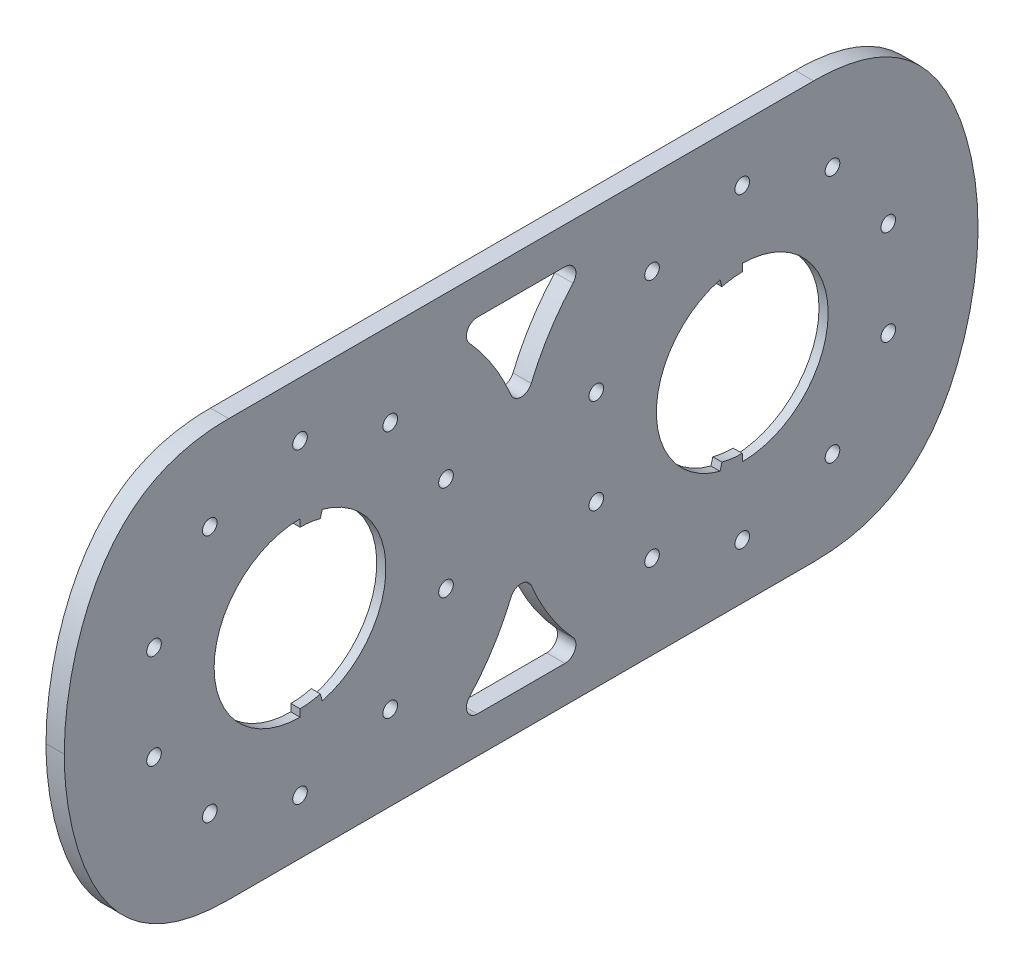
from build123d import *

# Parameters (mm, degrees)
EXTRUDE_1_DEPTH          = 5
SKETCH_2_R               = 31
CUT_EXTRUDE_1_DEPTH      = 2.5
CUT_EXTRUDE_2_REACH      = 139.474
SKETCH_3_R               = 2
PATTERN_CIRCULAR_1_COUNT = 10
CUT_EXTRUDE_3_REACH      = 139.405
SKETCH_4_R               = 23.5
EXTRUDE_START            = -2.5
EXTRUDE_3_DEPTH          = 2.5
CUT_EXTRUDE_4_DEPTH      = 10


with BuildPart() as part:
    # 草图1 → 凸台-拉伸1 (new body)
    with BuildSketch(Plane(origin=(0, 0, 0), x_dir=(0, 0, -1), z_dir=(1, 0, 0))):
        with BuildLine():
            Line((0, 57), (80, 57))
            add(Edge.make_bspline(
                [(80, 57), (110.715171184, 57), (118.023084898, 36.99301361), (125, 20.498008369), (125, 0)],
                knots=[0, 0, 0, 0, 0, 1, 1, 1, 1, 1], degree=4))
            add(Edge.make_bspline(
                [(80, -57), (110.715171184, -57), (118.023084898, -36.99301361), (125, -20.498008369), (125, 0)],
                knots=[0, 0, 0, 0, 0, 1, 1, 1, 1, 1], degree=4))
            Line((80, -57), (0, -57))
            Line((0, -57), (0, 57))
        make_face()
    extrude(amount=EXTRUDE_1_DEPTH)

    # 草图2 → 切除-拉伸1 (cut)
    with BuildSketch(Plane.ZY):
        with Locations((-60.5, 0)):
            Circle(SKETCH_2_R)
    extrude(amount=-CUT_EXTRUDE_1_DEPTH, mode=Mode.SUBTRACT)

    # 草图3 → 切除-拉伸2 (cut, up to next)
    with BuildSketch(Plane.ZY, mode=Mode.PRIVATE) as cut_extrude_2_sk1:
        with Locations((-60.5, 42)):
            Circle(SKETCH_3_R)
    cut_extrude_2_tool1 = extrude(cut_extrude_2_sk1.sketch, amount=-CUT_EXTRUDE_2_REACH, mode=Mode.PRIVATE) & part.part
    cut_extrude_2 = cut_extrude_2_tool1.solids().sort_by_distance((0, 42, -60.5))[0]
    add(cut_extrude_2, mode=Mode.SUBTRACT)

    # 阵列(圆周)1: 切除-拉伸2 ×10 about axis
    pattern_circular_1_axis = Axis((0, 0, -60.5), (1, 0, 0))
    for i in range(1, PATTERN_CIRCULAR_1_COUNT):
        add(cut_extrude_2.rotate(pattern_circular_1_axis, i * 360 / PATTERN_CIRCULAR_1_COUNT), mode=Mode.SUBTRACT)

    # 草图4 → 切除-拉伸3 (cut, up to next)
    with BuildSketch(Plane.ZY.offset(-2.5), mode=Mode.PRIVATE) as cut_extrude_3_sk1:
        with Locations((-60.5, 0)):
            Circle(SKETCH_4_R)
    cut_extrude_3_tool1 = extrude(cut_extrude_3_sk1.sketch, amount=-CUT_EXTRUDE_3_REACH, mode=Mode.PRIVATE) & part.part
    add(cut_extrude_3_tool1.solids().sort_by_distance((2.5, 0, -60.5))[0], mode=Mode.SUBTRACT)

    # 草图8 → 凸台-拉伸3 (add)
    with BuildSketch(Plane(origin=(5, 0, 0), x_dir=(0, 0, -1), z_dir=(1, 0, 0)).offset(EXTRUDE_START)):
        with BuildLine():
            Line((54.93539053, 20.767405265), (54.41775244, 22.699256918))
            ThreePointArc((54.41775244, 22.699256918), (57.432634483, 23.298954242), (60.5, 23.5))
            Line((60.5, 23.5), (60.5, 21.5))
            ThreePointArc((60.5, 21.5), (57.693686867, 21.31606452), (54.93539053, 20.767405265))
        make_face()
        with BuildLine():
            Line((60.5, -21.5), (60.5, -23.5))
            ThreePointArc((60.5, -23.5), (57.432634483, -23.298954242), (54.41775244, -22.699256918))
            Line((54.41775244, -22.699256918), (54.93539053, -20.767405265))
            ThreePointArc((54.93539053, -20.767405265), (57.693686867, -21.31606452), (60.5, -21.5))
        make_face()
    extrude(amount=EXTRUDE_3_DEPTH)

    # 镜向3: part across plane


with BuildPart() as part_1:
    add(part.part)
    add(part.part.mirror(Plane(origin=(5, 57, 0), x_dir=(1, 0, 0), z_dir=(0, 0, -1))))

    # 草图10 → 切除-拉伸4 (cut)
    with BuildSketch(Plane(origin=(5, 0, 0), x_dir=(0, 0, -1), z_dir=(1, 0, 0))):
        with BuildLine():
            Line((11.979385824, 47), (-11.979385824, 47))
            ThreePointArc((-11.979385824, 47), (-14.722176513, 45.215359715), (-14.201704031, 41.984732824))
            ThreePointArc((-14.201704031, 41.984732824), (-7.710501584, 33.45921184), (-2.770992366, 23.950191599))
            ThreePointArc((-2.770992366, 23.950191599), (0, 22.099800796), (2.770992366, 23.950191599))
            ThreePointArc((2.770992366, 23.950191599), (7.710501584, 33.45921184), (14.201704031, 41.984732824))
            ThreePointArc((14.201704031, 41.984732824), (14.722176513, 45.215359715), (11.979385824, 47))
        make_face()
        with BuildLine():
            Line((11.979385824, -47), (-11.979385824, -47))
            ThreePointArc((-11.979385824, -47), (-14.722176513, -45.215359715), (-14.201704031, -41.984732824))
            ThreePointArc((-14.201704031, -41.984732824), (-7.710501584, -33.45921184), (-2.770992366, -23.950191599))
            ThreePointArc((-2.770992366, -23.950191599), (0, -22.099800796), (2.770992366, -23.950191599))
            ThreePointArc((2.770992366, -23.950191599), (7.710501584, -33.45921184), (14.201704031, -41.984732824))
            ThreePointArc((14.201704031, -41.984732824), (14.722176513, -45.215359715), (11.979385824, -47))
        make_face()
    extrude(amount=-CUT_EXTRUDE_4_DEPTH, mode=Mode.SUBTRACT)


solid = part_1.part
